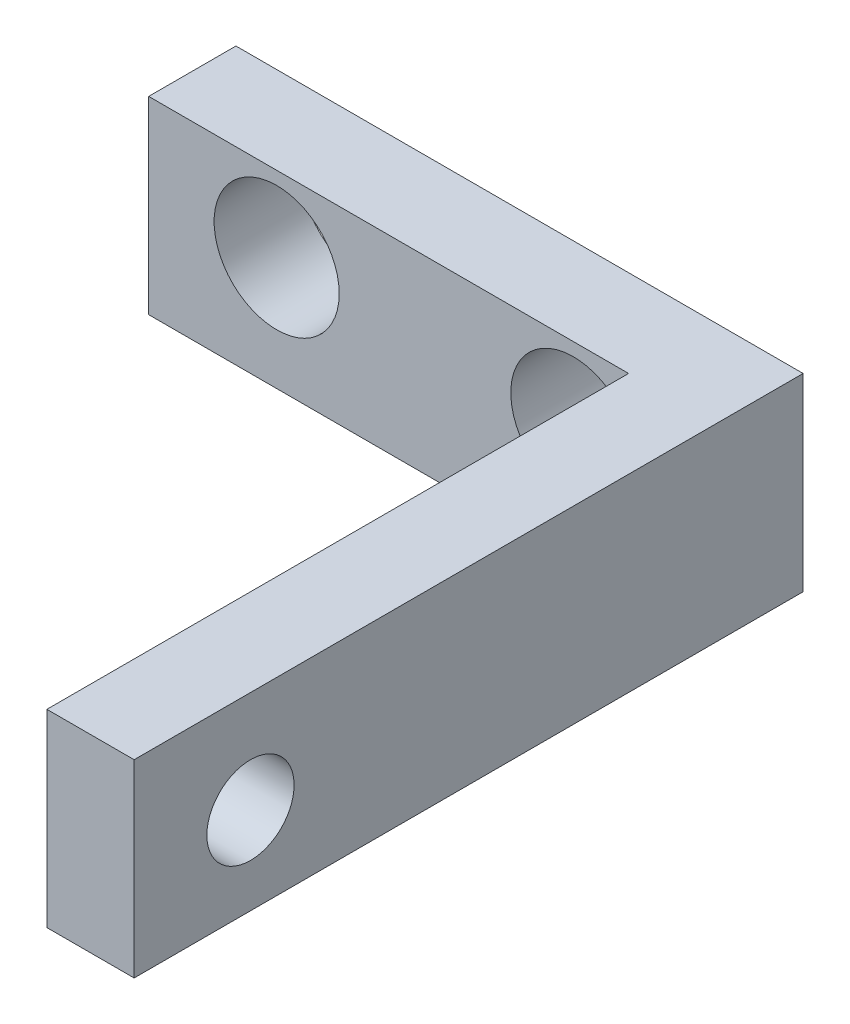
from build123d import *

# Parameters (mm, degrees)
SKETCH1_W               = 19.5
SKETCH1_H               = 6.5
BOSS_EXTRUDE1_DEPTH     = 3
SKETCH2_W               = 3
SKETCH2_H               = 6.5
BOSS_EXTRUDE2_DEPTH     = 20
SKETCH3_R               = 1.5
CUT_EXTRUDE1_DEPTH      = 10
CUT_EXTRUDE2_DEPTH      = 10
CUT_EXTRUDE2_DEPTH_BACK = 10
SKETCH4_R               = 2.15
SKETCH5_W               = 10.88141253
SKETCH5_H               = 4.494582939
CUT_EXTRUDE3_DEPTH      = 1


with BuildPart() as part:
    # Sketch1 → Boss-Extrude1 (new body)
    with BuildSketch(Plane.XY):
        with Locations((24.134573854, -21.008812853)):
            Rectangle(SKETCH1_W, SKETCH1_H)
    extrude(amount=BOSS_EXTRUDE1_DEPTH)

    # Sketch2 → Boss-Extrude2 (add)
    with BuildSketch(Plane.XY.offset(3)):
        with Locations((32.384573854, -21.008812853)):
            Rectangle(SKETCH2_W, SKETCH2_H)
    extrude(amount=BOSS_EXTRUDE2_DEPTH)

    # Sketch3 → Cut-Extrude1 (cut)
    with BuildSketch(Plane.ZY.offset(-30.884573854)):
        with Locations(Location((19, -21.258812853, 0), (0, 0, 270))):
            Circle(SKETCH3_R)
    extrude(amount=-CUT_EXTRUDE1_DEPTH, mode=Mode.SUBTRACT)

    # Sketch4 → Cut-Extrude2 (cut, two sides: drawn at the far end of the back side and taken through both)
    with BuildSketch(Plane.XY.offset(3).offset(-CUT_EXTRUDE2_DEPTH_BACK)):
        with Locations(Location((28.984573854, -20.358812853, 0), (0, 0, 27.905472791))):
            Circle(SKETCH4_R)
        with Locations((18.784573854, -20.358812853)):
            Circle(SKETCH4_R)
    extrude(amount=CUT_EXTRUDE2_DEPTH + CUT_EXTRUDE2_DEPTH_BACK, mode=Mode.SUBTRACT)

    # Sketch5 → Cut-Extrude3 (cut)
    with BuildSketch(Plane.ZY.offset(-30.884573854)):
        with Locations((8.440706265, -20.802989028)):
            Rectangle(SKETCH5_W, SKETCH5_H)
    extrude(amount=-CUT_EXTRUDE3_DEPTH, mode=Mode.SUBTRACT)


solid = part.part
